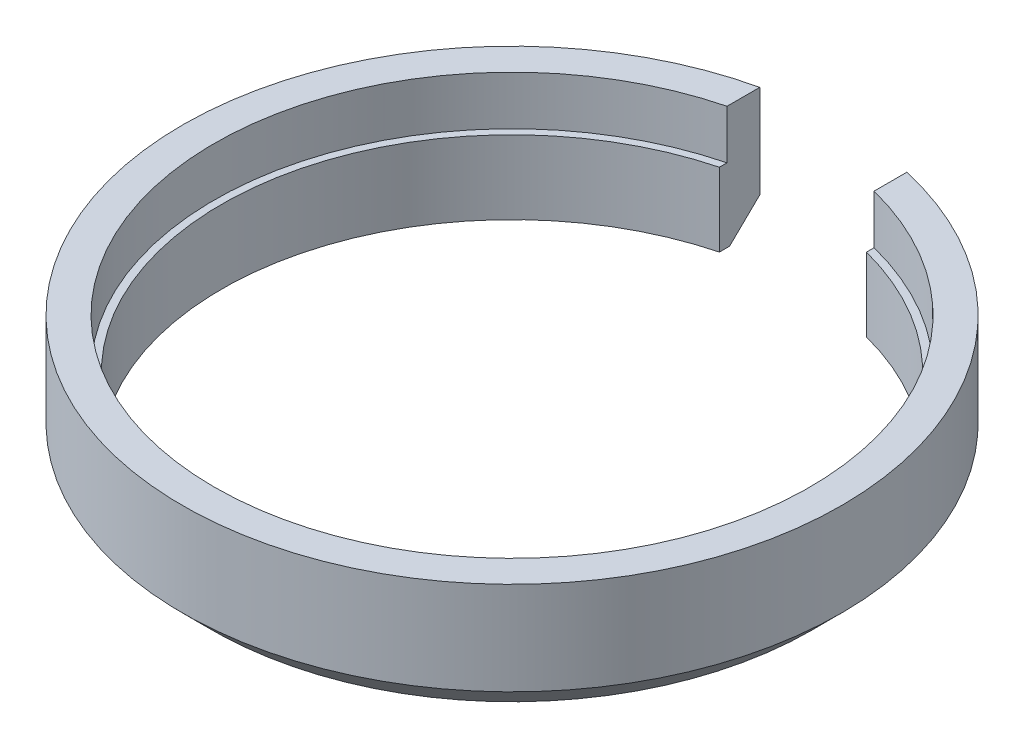
from build123d import *

# Parameters (mm, degrees)
CHAMFER_1_SIZE      = 1.2
CUT_EXTRUDE_1_REACH = 21.667
SKETCH_2_W          = 6
SKETCH_2_H          = 10


with BuildPart() as part:
    # Эскиз1 → Повернуть1 (revolve)
    with BuildSketch(Plane.XY, mode=Mode.PRIVATE) as revolve_1_sk:
        Polygon((-11.85, 0), (-13.45, 0), (-13.45, 5), (-12.15, 5), (-12.15, 3), (-11.85, 3), align=None)
    revolve(revolve_1_sk.sketch.rotate(Axis((0, 0, 0), (0, 1, 0)), 270), axis=Axis((0, 0, 0), (0, 1, 0)))

    # Фаска1
    chamfer_1_edges = [part.edges().sort_by_distance(p)[0] for p in [
        (0, 0, 13.45),
    ]]
    chamfer(chamfer_1_edges, length=CHAMFER_1_SIZE)

    # Эскиз2 → Вырез-Вытянуть1 (cut, up to next)
    with BuildSketch(Plane(origin=(0, 5, 0), x_dir=(1, 0, 0), z_dir=(0, 1, 0)), mode=Mode.PRIVATE) as cut_extrude_1_sk1:
        with Locations((0, 12)):
            Rectangle(SKETCH_2_W, SKETCH_2_H)
    cut_extrude_1_tool1 = extrude(cut_extrude_1_sk1.sketch, amount=-CUT_EXTRUDE_1_REACH, mode=Mode.PRIVATE) & part.part
    add(cut_extrude_1_tool1.solids().sort_by_distance((0, 5, -12))[0], mode=Mode.SUBTRACT)


solid = part.part
